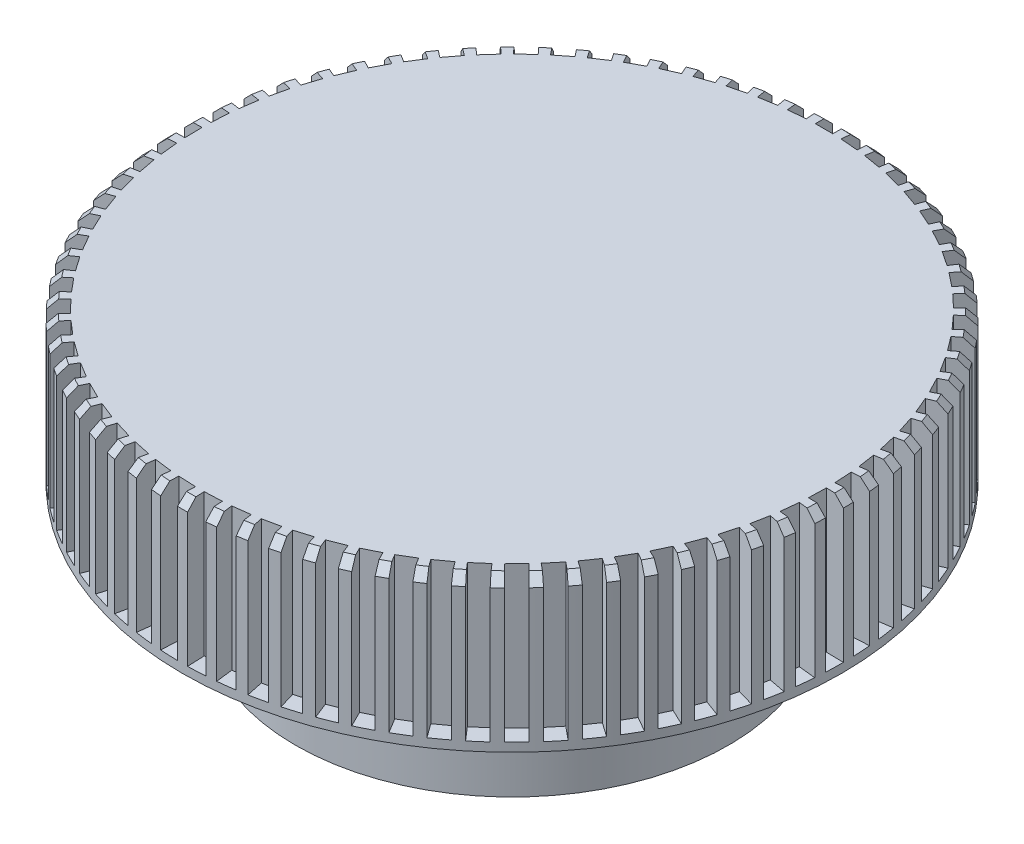
from build123d import *

# Parameters (mm, degrees)
CHAMFER1_SIZE      = 0.254
SKETCH2_W          = 0.508
SKETCH2_H          = 1.27
CUT_EXTRUDE1_DEPTH = 4.1402
CIRPATTERN1_COUNT  = 75


with BuildPart() as part:
    # Sketch1 → Revolve2 (revolve)
    with BuildSketch(Plane.XY, mode=Mode.PRIVATE) as revolve2_sk:
        Polygon((0, 0), (9.5885, 0), (9.5885, -4.3942), (7.4041, -4.3942), (7.4041, -1.1938), (6.2992, -1.1938), (6.2992, -7.8486), (4.7752, -7.8486), (4.7752, -1.1938), (2.7559, -1.1938), (2.7559, -4.6228), (0, -4.6228), align=None)
    revolve(revolve2_sk.sketch.rotate(Axis((0, 50, 0), (0, -1, 0)), 90), axis=Axis((0, 50, 0), (0, -1, 0)))

    # Chamfer1
    chamfer1_edges = [part.edges().sort_by_distance(p)[0] for p in [
        (0, 0, -9.5885),
    ]]
    chamfer(chamfer1_edges, length=CHAMFER1_SIZE)

    # Sketch2 → Cut-Extrude1 (cut)
    with BuildSketch(Plane(origin=(0, 0, 0), x_dir=(1, 0, 0), z_dir=(0, 1, 0))):
        with Locations((0, 9.7155)):
            Rectangle(SKETCH2_W, SKETCH2_H)
    cut_extrude1 = extrude(amount=-CUT_EXTRUDE1_DEPTH, mode=Mode.SUBTRACT)

    # CirPattern1: Cut-Extrude1 ×75 about axis
    cirpattern1_axis = Axis((0, 0, 0), (0, 1, 0))
    for i in range(1, CIRPATTERN1_COUNT):
        add(cut_extrude1.rotate(cirpattern1_axis, i * 360 / CIRPATTERN1_COUNT), mode=Mode.SUBTRACT)


solid = part.part
